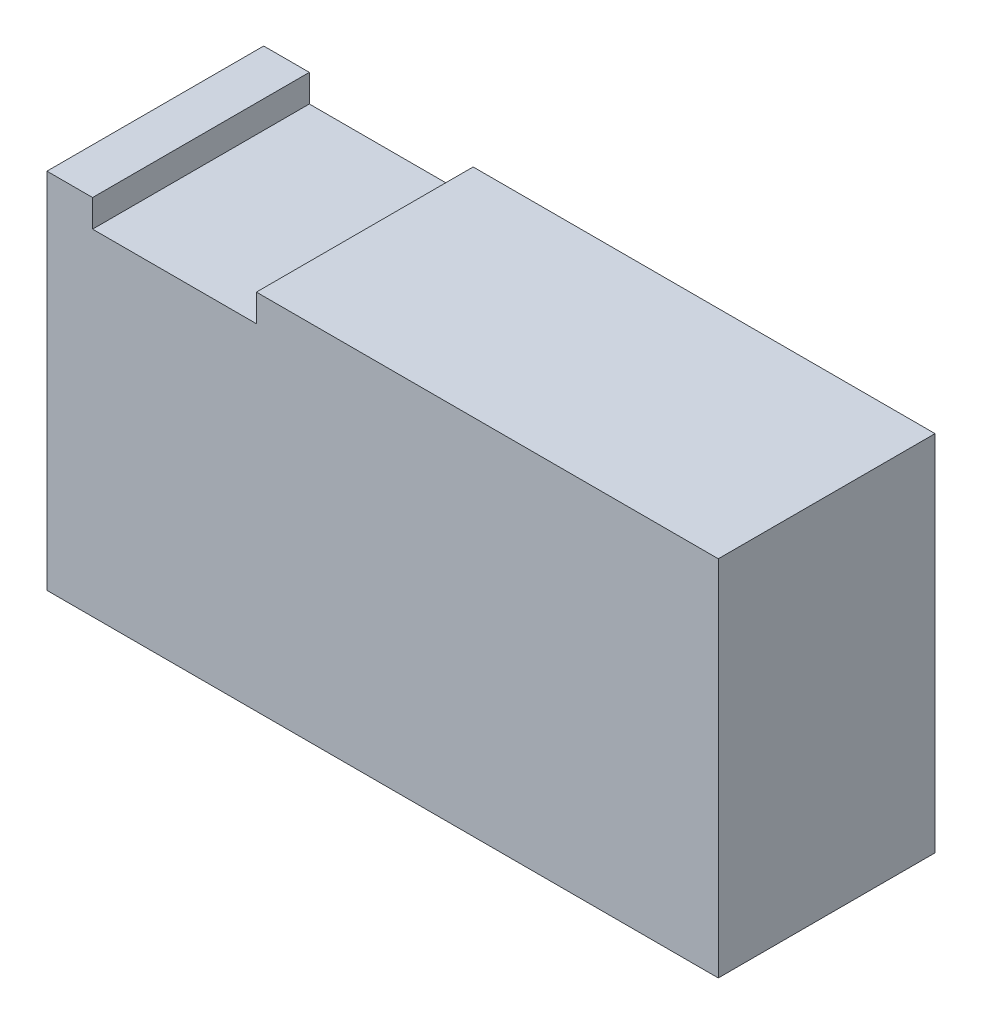
from build123d import *

# Parameters (mm, degrees)
SKETCH_200_W        = 62.5
SKETCH_200_H        = 20.18
EXTRUDE_1_DEPTH     = 33.8
SKETCH_6_W          = 15.25
SKETCH_6_H          = 20.18
CUT_EXTRUDE_1_DEPTH = 2.55


with BuildPart() as part:
    # Sketch 200 → Бобышка-Вытянуть1 (new body)
    with BuildSketch(Plane(origin=(0, 0, 0), x_dir=(1, 0, 0), z_dir=(0, 1, 0))):
        Rectangle(SKETCH_200_W, SKETCH_200_H)
    extrude(amount=EXTRUDE_1_DEPTH)

    # Эскиз6 → Вырез-Вытянуть1 (cut)
    with BuildSketch(Plane(origin=(0, 33.8, 0), x_dir=(1, 0, 0), z_dir=(0, 1, 0))):
        with Locations((-19.375, 0)):
            Rectangle(SKETCH_6_W, SKETCH_6_H)
    extrude(amount=-CUT_EXTRUDE_1_DEPTH, mode=Mode.SUBTRACT)


solid = part.part
